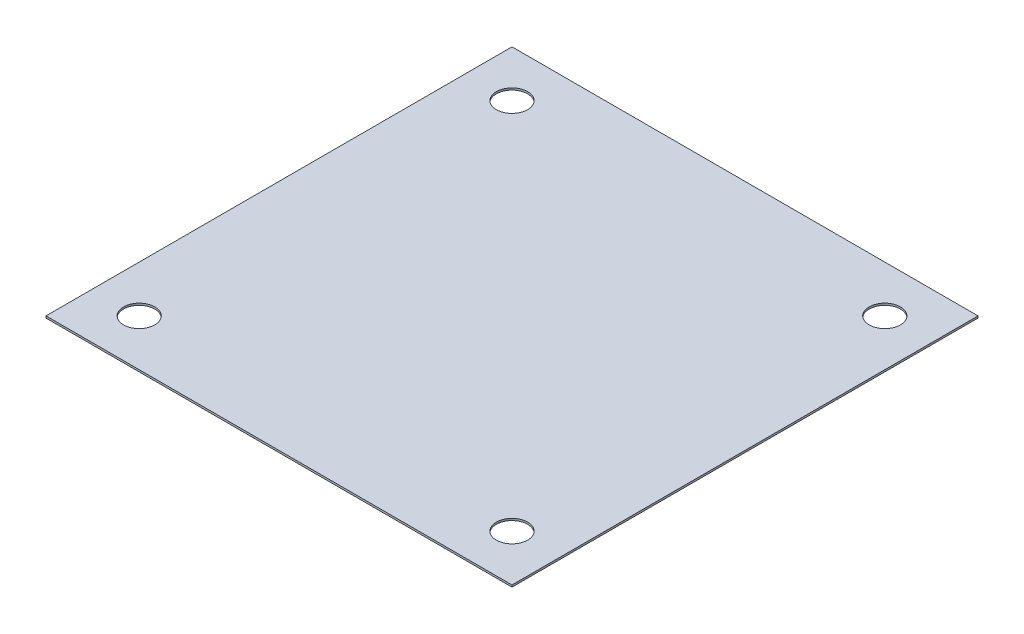
from build123d import *

# Parameters (mm, degrees)
SKETCH1_W           = 1524
SKETCH1_H           = 1524
BOSS_EXTRUDE1_DEPTH = 6.35
CUT_EXTRUDE1_REACH  = 1079.649
SKETCH2_R           = 51.1302


with BuildPart() as part:
    # Sketch1 → Boss-Extrude1 (new body)
    with BuildSketch(Plane(origin=(0, 0, 0), x_dir=(1, 0, 0), z_dir=(0, 1, 0))):
        Rectangle(SKETCH1_W, SKETCH1_H)
    extrude(amount=BOSS_EXTRUDE1_DEPTH)

    # Sketch2 → Cut-Extrude1 (cut, up to next)
    with BuildSketch(Plane(origin=(0, 6.35, 0), x_dir=(1, 0, 0), z_dir=(0, 1, 0)), mode=Mode.PRIVATE) as cut_extrude1_sk1:
        with Locations(Location((609.6, 609.6, 0), (0, 0, 270))):
            Circle(SKETCH2_R)
    cut_extrude1_tool1 = extrude(cut_extrude1_sk1.sketch, amount=-CUT_EXTRUDE1_REACH, mode=Mode.PRIVATE) & part.part
    # Sketch2 → Cut-Extrude1 (cut, up to next)
    with BuildSketch(Plane(origin=(0, 6.35, 0), x_dir=(1, 0, 0), z_dir=(0, 1, 0)), mode=Mode.PRIVATE) as cut_extrude1_sk2:
        with Locations(Location((609.6, -609.6, 0), (0, 0, 270))):
            Circle(SKETCH2_R)
    cut_extrude1_tool2 = extrude(cut_extrude1_sk2.sketch, amount=-CUT_EXTRUDE1_REACH, mode=Mode.PRIVATE) & part.part
    # Sketch2 → Cut-Extrude1 (cut, up to next)
    with BuildSketch(Plane(origin=(0, 6.35, 0), x_dir=(1, 0, 0), z_dir=(0, 1, 0)), mode=Mode.PRIVATE) as cut_extrude1_sk3:
        with Locations(Location((-609.6, -609.6, 0), (0, 0, 270))):
            Circle(SKETCH2_R)
    cut_extrude1_tool3 = extrude(cut_extrude1_sk3.sketch, amount=-CUT_EXTRUDE1_REACH, mode=Mode.PRIVATE) & part.part
    # Sketch2 → Cut-Extrude1 (cut, up to next)
    with BuildSketch(Plane(origin=(0, 6.35, 0), x_dir=(1, 0, 0), z_dir=(0, 1, 0)), mode=Mode.PRIVATE) as cut_extrude1_sk4:
        with Locations(Location((-609.6, 609.6, 0), (0, 0, 270))):
            Circle(SKETCH2_R)
    cut_extrude1_tool4 = extrude(cut_extrude1_sk4.sketch, amount=-CUT_EXTRUDE1_REACH, mode=Mode.PRIVATE) & part.part
    add(cut_extrude1_tool1.solids().sort_by_distance((609.6, 6.35, -609.6))[0], mode=Mode.SUBTRACT)
    add(cut_extrude1_tool2.solids().sort_by_distance((609.6, 6.35, 609.6))[0], mode=Mode.SUBTRACT)
    add(cut_extrude1_tool3.solids().sort_by_distance((-609.6, 6.35, 609.6))[0], mode=Mode.SUBTRACT)
    add(cut_extrude1_tool4.solids().sort_by_distance((-609.6, 6.35, -609.6))[0], mode=Mode.SUBTRACT)


solid = part.part
